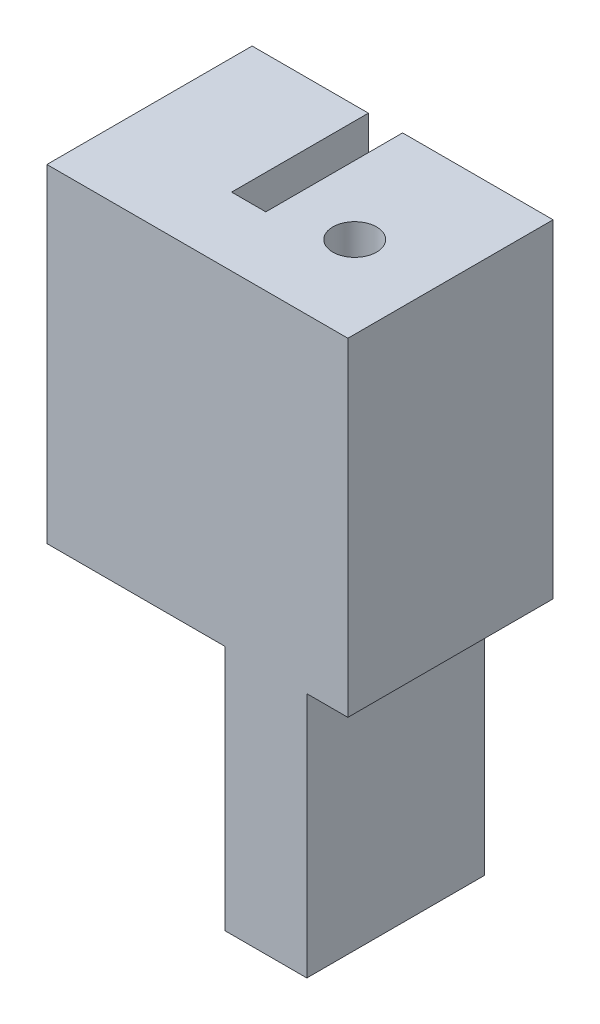
from build123d import *

# Parameters (mm, degrees)
BOSS_EXTRUDE1_DEPTH   = 10
BOSS_EXTRUDE1_2_DEPTH = 10
BOSS_EXTRUDE1_3_DEPTH = 10
SKETCH3_W             = 13
SKETCH3_H             = 24
BOSS_EXTRUDE2_DEPTH   = 5
SKETCH4_W             = 6
SKETCH4_H             = 13
BOSS_EXTRUDE3_DEPTH   = 42
SKETCH5_W             = 6
SKETCH5_H             = 24
BOSS_EXTRUDE4_DEPTH   = 2
SKETCH6_R             = 1.6
CUT_EXTRUDE1_DEPTH    = 60.575582246
SKETCH8_W             = 15
SKETCH8_H             = 24
BOSS_EXTRUDE5_DEPTH   = 3
SKETCH7_W             = 5.75
SKETCH7_H             = 2.65
CUT_EXTRUDE2_DEPTH    = 12.5


with BuildPart() as part:
    # Sketch2 → Boss-Extrude1 (new body)
    with BuildSketch(Plane.XY):
        with BuildLine():
            Line((-26.5, 0), (-30.65, 0))
            Line((-30.65, 0), (-32.618157491, 0))
            Line((-32.618157491, 0), (-31.015837104, 1.142896884))
            ThreePointArc((-31.015837104, 1.142896884), (-29.165912572, 3.280355677), (-28.5, 6.027629109))
            Line((-28.5, 6.027629109), (-28.5, 24))
            Line((-28.5, 24), (-26.5, 24))
            Line((-26.5, 24), (-26.5, 0))
        make_face()
    extrude(amount=BOSS_EXTRUDE1_DEPTH)



with BuildPart() as body_2:
    # Sketch2 → Boss-Extrude1 2 (new body)
    with BuildSketch(Plane.XY):
        with BuildLine():
            Line((-31, 24), (-39.5, 24))
            Line((-39.5, 24), (-39.5, 8.68))
            Line((-39.5, 8.68), (-39.5, 6.362551494))
            Line((-39.5, 6.362551494), (-38.492686138, 8.449627525))
            ThreePointArc((-38.492686138, 8.449627525), (-37.750547948, 9.507229314), (-36.71, 10.273095232))
            Line((-36.71, 10.273095232), (-31, 13.19))
            Line((-31, 13.19), (-31, 24))
        make_face()
    extrude(amount=BOSS_EXTRUDE1_2_DEPTH)


with BuildPart() as body_3:
    # Sketch2 → Boss-Extrude1 3 (new body)
    with BuildSketch(Plane.XY):
        with BuildLine():
            Line((-30.2, 5.530404879), (-30.2, 11.689701848))
            Line((-30.2, 11.689701848), (-35.685050881, 8.887710417))
            ThreePointArc((-35.685050881, 8.887710417), (-35.938141024, 2.314923436), (-30.2, 5.530404879))
        make_face()
    extrude(amount=BOSS_EXTRUDE1_3_DEPTH)


with BuildPart() as part_1:
    add(part.part)

    add(body_2.part)  # Boss-Extrude2 merges body 2

    add(body_3.part)  # Boss-Extrude2 merges body 3
    # Sketch3 → Boss-Extrude2 (add)
    with BuildSketch(Plane.XY.offset(10)):
        with Locations((-33, 12)):
            Rectangle(SKETCH3_W, SKETCH3_H)
    extrude(amount=BOSS_EXTRUDE2_DEPTH)

    # Sketch4 → Boss-Extrude3 (add)
    with BuildSketch(Plane(origin=(0, 24, 0), x_dir=(1, 0, 0), z_dir=(0, 1, 0))):
        with Locations((-23.5, -8.5)):
            Rectangle(SKETCH4_W, SKETCH4_H)
    extrude(amount=-BOSS_EXTRUDE3_DEPTH)

    # Sketch5 → Boss-Extrude4 (add)
    with BuildSketch(Plane(origin=(0, 0, 2), x_dir=(-1, 0, 0), z_dir=(0, 0, -1))):
        with Locations((23.5, 12)):
            Rectangle(SKETCH5_W, SKETCH5_H)
    extrude(amount=BOSS_EXTRUDE4_DEPTH)

    # Sketch6 → Cut-Extrude1 (cut, through all)
    with BuildSketch(Plane.XZ.offset(18)):
        with Locations(Location((-23.5, 8.5, 0), (0, 0, 270))):
            Circle(SKETCH6_R)
    extrude(amount=-CUT_EXTRUDE1_DEPTH, mode=Mode.SUBTRACT)

    # Sketch8 → Boss-Extrude5 (add)
    with BuildSketch(Plane(origin=(-20.5, 0, 0), x_dir=(0, 0, -1), z_dir=(1, 0, 0))):
        with Locations((-7.5, 12)):
            Rectangle(SKETCH8_W, SKETCH8_H)
    extrude(amount=BOSS_EXTRUDE5_DEPTH)

    # Sketch7 → Cut-Extrude2 (cut)
    with BuildSketch(Plane(origin=(0, 0, 0), x_dir=(-1, 0, 0), z_dir=(0, 0, -1))):
        with Locations((23.5, 3.325)):
            Rectangle(SKETCH7_W, SKETCH7_H)
    extrude(amount=-CUT_EXTRUDE2_DEPTH, mode=Mode.SUBTRACT)


solid = part_1.part
